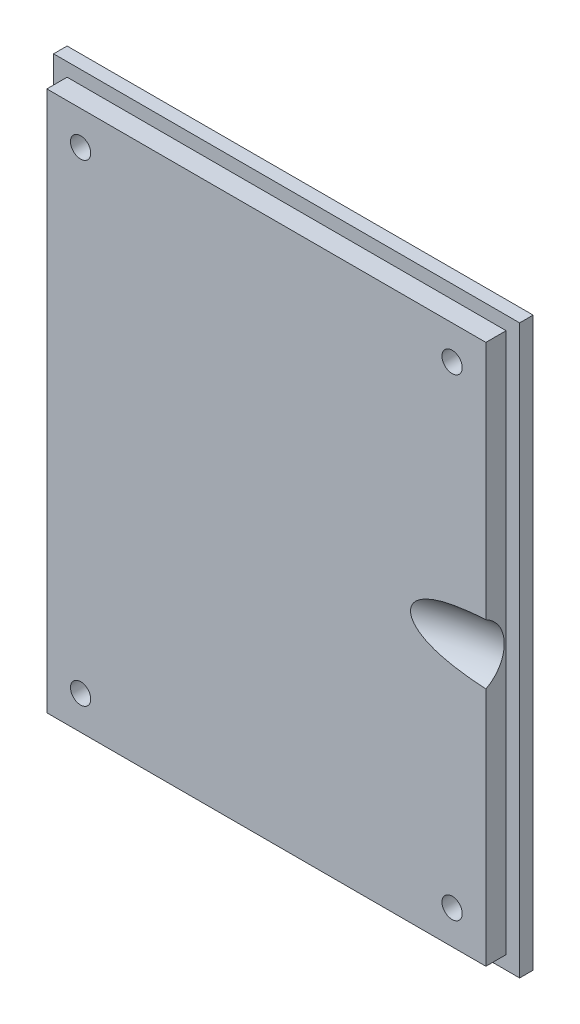
from build123d import *

# Parameters (mm, degrees)
SKETCH_1_W          = 65
SKETCH_1_H          = 80
EXTRUDE_1_DEPTH     = 5
SKETCH_1_3_W        = 69
SKETCH_1_3_H        = 84
SKETCH_1_3_W_2      = 65
SKETCH_1_3_H_2      = 80
EXTRUDE_2_DEPTH     = 2
SWEEP_1_PROFILE_R   = 5
SKETCH_8_R          = 1.5
CUT_EXTRUDE_1_DEPTH = 55.582506364


with BuildPart() as part:
    # 草图1 → 凸台-拉伸1 (new body)
    with BuildSketch(Plane.XY):
        Rectangle(SKETCH_1_W, SKETCH_1_H)
    extrude(amount=EXTRUDE_1_DEPTH)

    # 草图1<3> → 凸台-拉伸2 (add)
    with BuildSketch(Plane.XY):
        Rectangle(SKETCH_1_3_W, SKETCH_1_3_H)
        Rectangle(SKETCH_1_3_W_2, SKETCH_1_3_H_2, mode=Mode.SUBTRACT)
    extrude(amount=EXTRUDE_2_DEPTH)

    # 切除-扫描1: sweep along a path in 草图3
    with BuildLine(Plane(origin=(0, 0, 0), x_dir=(1, 0, 0), z_dir=(0, 1, 0))) as sweep_1_path:
        ThreePointArc((37.5, -7), (27.147238196, -8.362966948), (17.5, -12.358983849))
    # 切除-扫描1 profile (on start of the path) → 切除-扫描1 (sweep, cut)
    with BuildSketch(Plane(origin=(37.5, 0, 7), x_dir=(0, 0, -1), z_dir=(-1, 0, 0))):
        Circle(SWEEP_1_PROFILE_R)
    sweep(path=sweep_1_path.line, mode=Mode.SUBTRACT)

    # 草图8 → 切除-拉伸1 (cut, through all)
    with BuildSketch(Plane(origin=(0, 0, 0), x_dir=(-1, 0, 0), z_dir=(0, 0, -1))):
        with Locations((-27.5, 35)):
            Circle(SKETCH_8_R)
        with Locations((27.5, 35)):
            Circle(SKETCH_8_R)
        with Locations((27.5, -35)):
            Circle(SKETCH_8_R)
        with Locations((-27.5, -35)):
            Circle(SKETCH_8_R)
    extrude(amount=-CUT_EXTRUDE_1_DEPTH, mode=Mode.SUBTRACT)


solid = part.part
